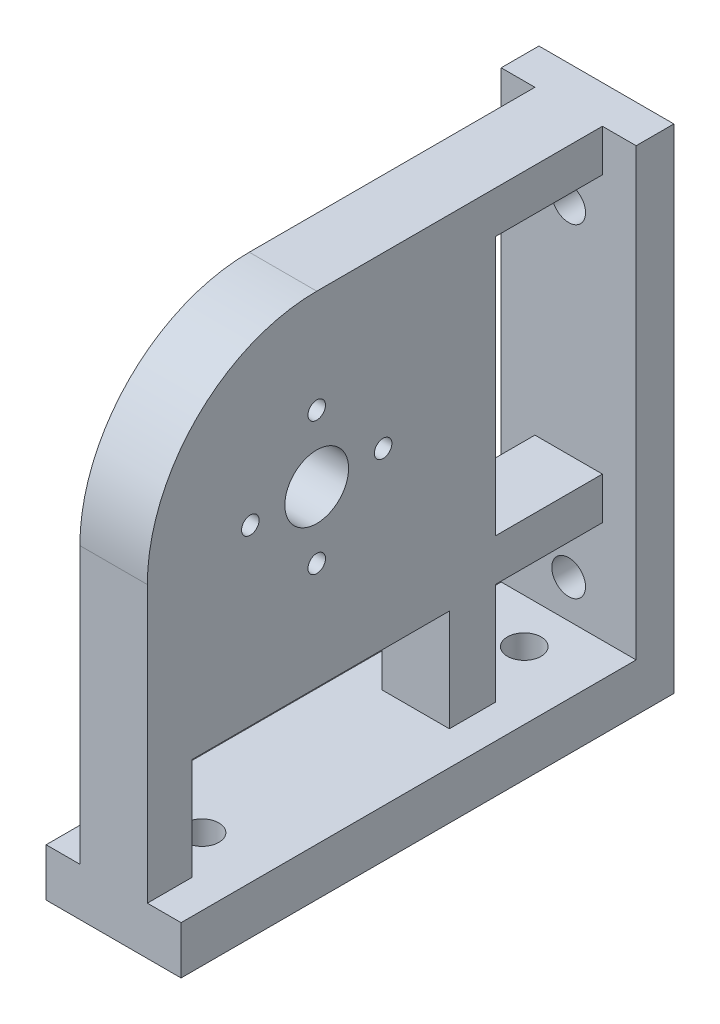
from build123d import *

# Parameters (mm, degrees)
SKETCH1_R                = 6
BOSS_EXTRUDE1_DEPTH      = 12.7
BOSS_EXTRUDE2_DEPTH      = 6.35
BOSS_EXTRUDE2_DEPTH_BACK = 19.05
SKETCH4_W                = 20.078494948
SKETCH4_H                = 48.78095735
SKETCH4_W_2              = 48.420880553
SKETCH4_H_2              = 19.195923741
CUT_EXTRUDE2_DEPTH       = 26.162
SKETCH5_R                = 3.175
CUT_EXTRUDE3_DEPTH       = 11.43
SKETCH6_R                = 3.175
CUT_EXTRUDE4_DEPTH       = 11.43
SKETCH11_R               = 1.65
CUT_EXTRUDE7_DEPTH       = 21.844


with BuildPart() as part:
    # Sketch1 → Boss-Extrude1 (new body)
    with BuildSketch(Plane(origin=(0, 0, 0), x_dir=(0, 0, -1), z_dir=(1, 0, 0))):
        with BuildLine():
            Line((0, 31.882172919), (31.882172919, 31.882172919))
            Line((31.882172919, 31.882172919), (60.87463474, 31.882172919))
            Line((60.87463474, 31.882172919), (60.87463474, -60.96))
            Line((60.87463474, -60.96), (-31.882172919, -60.96))
            Line((-31.882172919, -60.96), (-31.882172919, 0))
            ThreePointArc((-31.882172919, 0), (-22.54410067, 22.54410067), (0, 31.882172919))
        make_face()
        Circle(SKETCH1_R, mode=Mode.SUBTRACT)
    extrude(amount=BOSS_EXTRUDE1_DEPTH)

    # Sketch8 → Boss-Extrude2 (add, two sides: drawn at the far end of the back side and taken through both)
    with BuildSketch(Plane(origin=(12.7, 0, 0), x_dir=(0, 0, -1), z_dir=(1, 0, 0)).offset(-BOSS_EXTRUDE2_DEPTH_BACK)):
        Polygon((60.87463474, 31.882172919), (53.770648903, 31.882172919), (53.770648903, -51.937867719), (-31.882172919, -51.937867719), (-31.882172919, -60.96), (53.770648903, -60.96), (60.87463474, -60.96), align=None)
    extrude(amount=BOSS_EXTRUDE2_DEPTH + BOSS_EXTRUDE2_DEPTH_BACK)

    # Sketch4 → Cut-Extrude2 (cut)
    with BuildSketch(Plane.ZY):
        with Locations((-43.731401429, -0.427222634)):
            Rectangle(SKETCH4_W, SKETCH4_H)
        with Locations((-0.75610861, -42.339905849)):
            Rectangle(SKETCH4_W_2, SKETCH4_H_2)
        with Locations((-43.731401429, -42.339905849)):
            Rectangle(SKETCH4_W, SKETCH4_H_2)
    extrude(amount=-CUT_EXTRUDE2_DEPTH, mode=Mode.SUBTRACT)

    # Sketch5 → Cut-Extrude3 (cut)
    with BuildSketch(Plane(origin=(0, 0, -60.87463474), x_dir=(-1, 0, 0), z_dir=(0, 0, -1))):
        with Locations((-6.35, 16.187024645)):
            Circle(SKETCH5_R)
        with Locations((-6.35, -44.788648077)):
            Circle(SKETCH5_R)
    extrude(amount=-CUT_EXTRUDE3_DEPTH, mode=Mode.SUBTRACT)

    # Sketch6 → Cut-Extrude4 (cut)
    with BuildSketch(Plane.XZ.offset(60.96)):
        with Locations((6.35, 15.24)):
            Circle(SKETCH6_R)
        with Locations((6.35, -45.41055385)):
            Circle(SKETCH6_R)
    extrude(amount=-CUT_EXTRUDE4_DEPTH, mode=Mode.SUBTRACT)

    # Sketch11 → Cut-Extrude7 (cut)
    with BuildSketch(Plane(origin=(12.7, 0, 0), x_dir=(0, 0, -1), z_dir=(1, 0, 0))):
        with Locations((0, -12.5)):
            Circle(SKETCH11_R)
        with Locations((-12.5, 0)):
            Circle(SKETCH11_R)
        with Locations((0, 12.5)):
            Circle(SKETCH11_R)
        with Locations((12.5, 0)):
            Circle(SKETCH11_R)
    extrude(amount=-CUT_EXTRUDE7_DEPTH, mode=Mode.SUBTRACT)


solid = part.part
